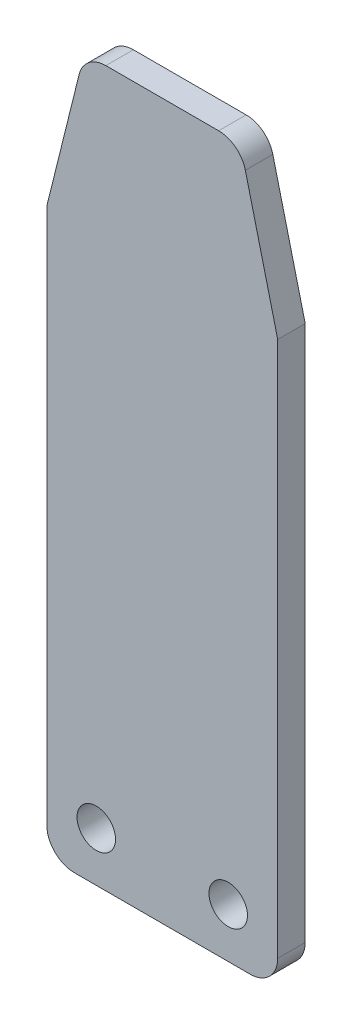
from build123d import *

# Parameters (mm, degrees)
SKETCH1_R           = 7
BOSS_EXTRUDE1_DEPTH = 10


with BuildPart() as part:
    # Sketch1 → Boss-Extrude1 (new body)
    with BuildSketch(Plane.XY):
        with BuildLine():
            Line((-20.517714388, 260), (20.517714388, 260))
            ThreePointArc((20.517714388, 260), (26.67774114, 257.877440601), (30.222763355, 252.410814084))
            Line((30.222763355, 252.410814084), (42, 205))
            Line((42, 205), (42, 10))
            ThreePointArc((42, 10), (39.071067812, 2.928932188), (32, 0))
            Line((32, 0), (-32, 0))
            ThreePointArc((-32, 0), (-39.071067812, 2.928932188), (-42, 10))
            Line((-42, 10), (-42, 205))
            Line((-42, 205), (-30.222763355, 252.410814084))
            ThreePointArc((-30.222763355, 252.410814084), (-26.67774114, 257.877440601), (-20.517714388, 260))
        make_face()
        with Locations((24, 18)):
            Circle(SKETCH1_R, mode=Mode.SUBTRACT)
        with Locations(Location((-24, 18, 0), (0, 0, 180))):
            Circle(SKETCH1_R, mode=Mode.SUBTRACT)
    extrude(amount=BOSS_EXTRUDE1_DEPTH)


solid = part.part
